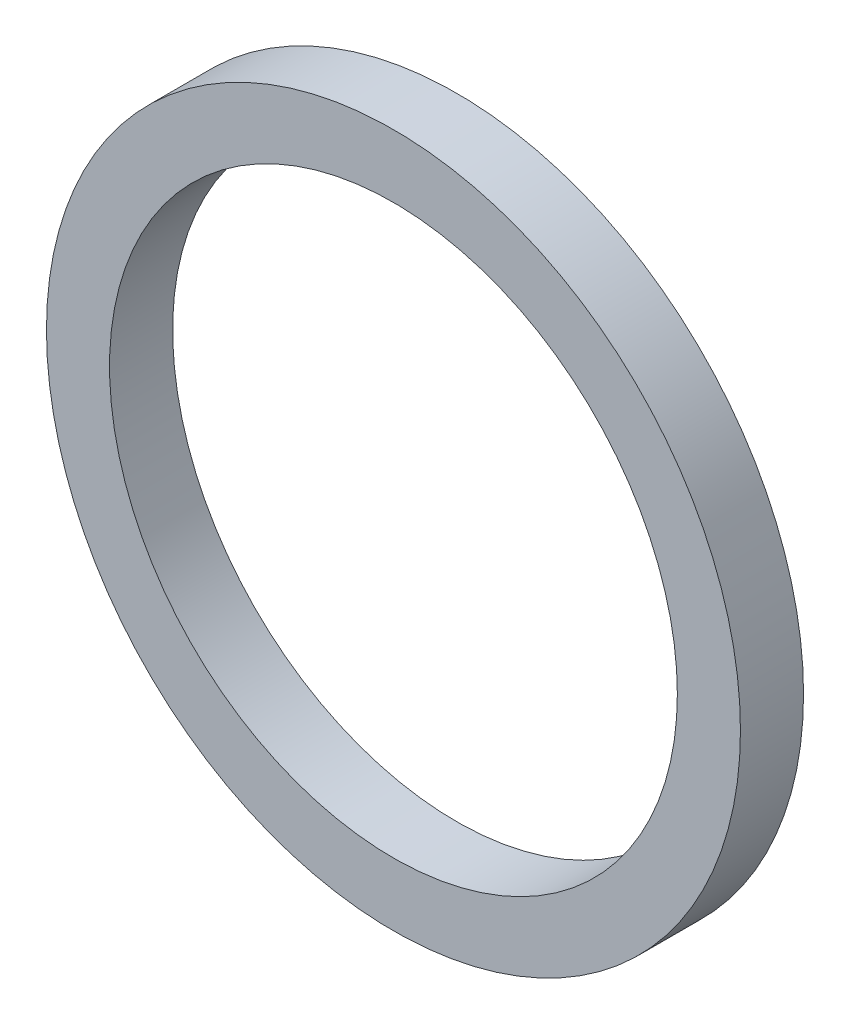
from build123d import *

# Parameters (mm, degrees)
SZKIC1_R                    = 55
SZKIC1_R_2                  = 45
DODANIE_WYCI_GNI_CIE1_DEPTH = 10


with BuildPart() as part:
    # Szkic1 → Dodanie-wyciągnięcie1 (new body)
    with BuildSketch(Plane.XY):
        Circle(SZKIC1_R)
        Circle(SZKIC1_R_2, mode=Mode.SUBTRACT)
    extrude(amount=DODANIE_WYCI_GNI_CIE1_DEPTH)


solid = part.part
